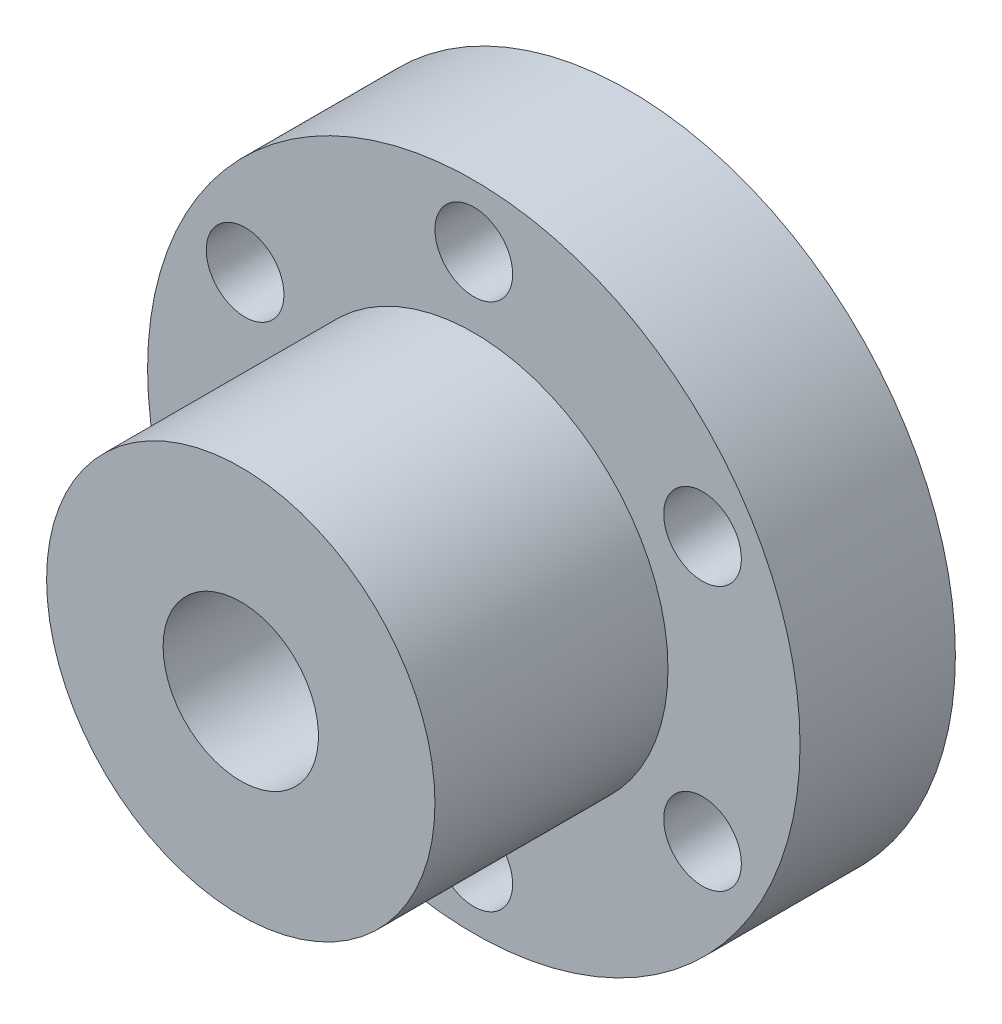
from build123d import *

# Parameters (mm, degrees)
SZKIC1_R                               = 21
DODANIE_WYCI_GNI_CIE1_DEPTH            = 10
SZKIC2_R                               = 12.5
DODANIE_WYCI_GNI_CIE2_DEPTH            = 15
OTWORY_USTALAJ_CE_5_0MM1_D             = 5
SZYK_KO_OWY1_COUNT                     = 6
WYTNIJ_WYCI_GNI_CIE1_REACH             = 40.82
SZKIC8_R                               = 5
WYTNIJ_WYCI_GNI_CIE1_DIRECTION_2_DEPTH = 39.820097888


with BuildPart() as part:
    # Szkic1 → Dodanie-wyciągnięcie1 (new body)
    with BuildSketch(Plane.XY):
        Circle(SZKIC1_R)
    extrude(amount=DODANIE_WYCI_GNI_CIE1_DEPTH)

    # Szkic2 → Dodanie-wyciągnięcie2 (add)
    with BuildSketch(Plane.XY.offset(10)):
        Circle(SZKIC2_R)
    extrude(amount=DODANIE_WYCI_GNI_CIE2_DEPTH)

    # Otwory ustalające Ø5.0mm1 (through all)
    with Locations(Plane.XY.offset(10)):
        with Locations((0, 17)):
            otwory_ustalaj_ce_5_0mm1 = Hole(OTWORY_USTALAJ_CE_5_0MM1_D / 2)

    # Szyk kołowy1: Otwory ustalające Ø5.0mm1 ×6 about axis
    szyk_ko_owy1_axis = Axis((0, 0, 0), (0, 0, 1))
    for i in range(1, SZYK_KO_OWY1_COUNT):
        add(otwory_ustalaj_ce_5_0mm1.rotate(szyk_ko_owy1_axis, i * 360 / SZYK_KO_OWY1_COUNT), mode=Mode.SUBTRACT)

    # Szkic8 → Wytnij-wyciągnięcie1 (cut, up to next)
    with BuildSketch(Plane.XY.offset(25), mode=Mode.PRIVATE) as wytnij_wyci_gni_cie1_sk1:
        with Locations(Location((0, 0, 0), (0, 0, 180))):
            Circle(SZKIC8_R)
    wytnij_wyci_gni_cie1_tool1 = extrude(wytnij_wyci_gni_cie1_sk1.sketch, amount=-WYTNIJ_WYCI_GNI_CIE1_REACH, mode=Mode.PRIVATE) & part.part
    add(wytnij_wyci_gni_cie1_tool1.solids().sort_by_distance((0, 0, 25))[0], mode=Mode.SUBTRACT)

    # Szkic8 → Wytnij-wyciągnięcie1 direction 2 (cut)
    with BuildSketch(Plane.XY.offset(25)):
        with Locations(Location((0, 0, 0), (0, 0, 180))):
            Circle(SZKIC8_R)
    extrude(amount=WYTNIJ_WYCI_GNI_CIE1_DIRECTION_2_DEPTH, mode=Mode.SUBTRACT)


solid = part.part
